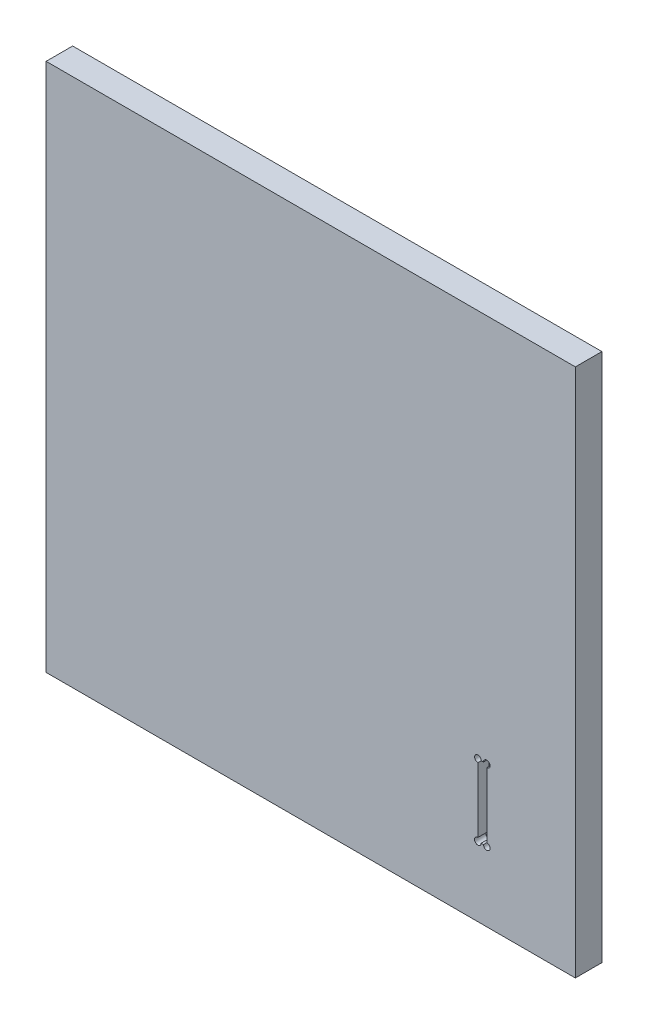
from build123d import *

# Parameters (mm, degrees)
SKETCH1_W        = 380
SKETCH1_H        = 380
SPOILBOARD_DEPTH = 19.05
SLOT_DEPTH       = 8


with BuildPart() as part:
    # Sketch1 → Spoilboard (new body)
    with BuildSketch(Plane.XY):
        Rectangle(SKETCH1_W, SKETCH1_H)
    extrude(amount=SPOILBOARD_DEPTH)

    # Sketch2 → Slot (cut)
    with BuildSketch(Plane.XY.offset(19.05)):
        with BuildLine():
            Line((120, -137.61875), (120, -91.081118763))
            ThreePointArc((120, -91.081118763), (118.350064134, -87.007386221), (122.40625, -88.7))
            Line((122.40625, -88.7), (124.01875, -88.7))
            ThreePointArc((124.01875, -88.7), (128.083798023, -87.016201977), (126.4, -91.08125))
            Line((126.4, -91.08125), (126.4, -137.61875))
            ThreePointArc((126.4, -137.61875), (128.083798023, -141.683798023), (124.01875, -140))
            Line((124.01875, -140), (122.38125, -140))
            ThreePointArc((122.38125, -140), (118.316201977, -141.683798023), (120, -137.61875))
        make_face()
    extrude(amount=-SLOT_DEPTH, mode=Mode.SUBTRACT)


solid = part.part
